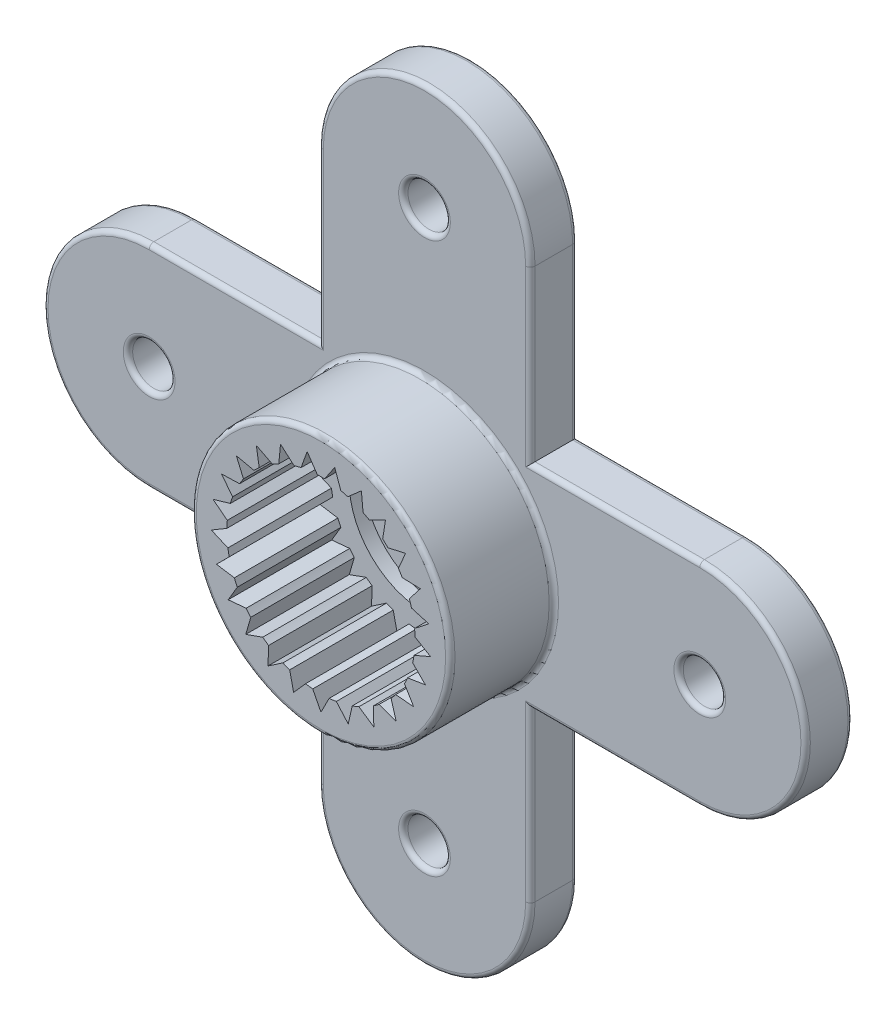
from build123d import *

# Parameters (mm, degrees)
ESQUISSE1_R             = 2.75
BOSS_EXTRU_1_DEPTH      = 1
ESQUISSE2_R             = 2.75
BOSS_EXTRU_2_DEPTH      = 2.2
ESQUISSE3_R             = 2
ENL_V_MAT_EXTRU_1_DEPTH = 2.5
ESQUISSE4_R             = 1.6
ENL_V_MAT_EXTRU_2_DEPTH = 0.4
ESQUISSE5_R             = 0.85
ENL_V_MAT_EXTRU_3_DEPTH = 4.8
ESQUISSE6_R             = 0.45
ENL_V_MAT_EXTRU_4_DEPTH = 10.133044399
CUT_EXTRUDE1_DEPTH      = 2.5
CIRPATTERN1_COUNT       = 25
BOSS_EXTRUDE1_DEPTH     = 1
SKETCH3_R               = 0.45
CUT_EXTRUDE2_DEPTH      = 10.133044399
SKETCH5_R               = 1.6
BOSS_EXTRUDE3_DEPTH     = 1
SKETCH9_R               = 0.45
CUT_EXTRUDE6_DEPTH      = 12.893695809
FILLET5_R               = 0.1


with BuildPart() as part:
    # Esquisse1 → Boss.-Extru.1 (new body)
    with BuildSketch(Plane.XY):
        with BuildLine():
            ThreePointArc((2.25, 5.85), (0, 8.1), (-2.25, 5.85))
            Line((-2.25, 5.85), (-2.25, 1.58113883))
            ThreePointArc((-2.25, 1.58113883), (0, 2.75), (2.25, 1.58113883))
            Line((2.25, 1.58113883), (2.25, 5.85))
        make_face()
        Circle(ESQUISSE1_R)
    extrude(amount=BOSS_EXTRU_1_DEPTH)

    # Esquisse2 → Boss.-Extru.2 (add)
    with BuildSketch(Plane.XY.offset(1)):
        with Locations(Location((0, 0, 0), (0, 0, 144.903198772))):
            Circle(ESQUISSE2_R)
    extrude(amount=BOSS_EXTRU_2_DEPTH)

    # Esquisse3 → Enlèv. mat.-Extru.1 (cut)
    with BuildSketch(Plane.XY.offset(3.2)):
        Circle(ESQUISSE3_R)
    extrude(amount=-ENL_V_MAT_EXTRU_1_DEPTH, mode=Mode.SUBTRACT)

    # Esquisse4 → Enlèv. mat.-Extru.2 (cut)
    with BuildSketch(Plane(origin=(0, 0, 0), x_dir=(-1, 0, 0), z_dir=(0, 0, -1))):
        Circle(ESQUISSE4_R)
    extrude(amount=-ENL_V_MAT_EXTRU_2_DEPTH, mode=Mode.SUBTRACT)

    # Esquisse5 → Enlèv. mat.-Extru.3 (cut)
    with BuildSketch(Plane(origin=(0, 0, 0.4), x_dir=(-1, 0, 0), z_dir=(0, 0, -1))):
        Circle(ESQUISSE5_R)
    extrude(amount=-ENL_V_MAT_EXTRU_3_DEPTH, mode=Mode.SUBTRACT)

    # Esquisse6 → Enlèv. mat.-Extru.4 (cut, through all)
    with BuildSketch(Plane(origin=(0, 0, 0), x_dir=(-1, 0, 0), z_dir=(0, 0, -1))):
        with Locations((0, 5.85)):
            Circle(ESQUISSE6_R)
    extrude(amount=-ENL_V_MAT_EXTRU_4_DEPTH, mode=Mode.SUBTRACT)

    # Sketch1 → Cut-Extrude1 (cut)
    with BuildSketch(Plane.XY.offset(3.2)):
        with BuildLine():
            Line((0.174311485, -1.992389396), (0, -2.334))
            Line((0, -2.334), (-0.174311485, -1.992389396))
            ThreePointArc((-0.174311485, -1.992389396), (0, -2), (0.174311485, -1.992389396))
        make_face()
    cut_extrude1 = extrude(amount=-CUT_EXTRUDE1_DEPTH, mode=Mode.SUBTRACT)

    # CirPattern1: Cut-Extrude1 ×25 about axis
    cirpattern1_axis = Axis((0, 0, 0), (0, 0, 1))
    for i in range(1, CIRPATTERN1_COUNT):
        add(cut_extrude1.rotate(cirpattern1_axis, i * 360 / CIRPATTERN1_COUNT), mode=Mode.SUBTRACT)

    # Sketch2 → Boss-Extrude1 (add)
    with BuildSketch(Plane(origin=(0, 0, 0), x_dir=(-1, 0, 0), z_dir=(0, 0, -1))):
        with BuildLine():
            Line((2.25, -1.58113883), (2.25, -5.85))
            ThreePointArc((2.25, -5.85), (0, -8.1), (-2.25, -5.85))
            Line((-2.25, -5.85), (-2.25, -1.58113883))
            ThreePointArc((-2.25, -1.58113883), (0, -2.75), (2.25, -1.58113883))
        make_face()
    extrude(amount=-BOSS_EXTRUDE1_DEPTH)

    # Sketch3 → Cut-Extrude2 (cut, through all)
    with BuildSketch(Plane(origin=(0, 0, 0), x_dir=(-1, 0, 0), z_dir=(0, 0, -1))):
        with Locations((0, -5.85)):
            Circle(SKETCH3_R)
    extrude(amount=-CUT_EXTRUDE2_DEPTH, mode=Mode.SUBTRACT)

    # Sketch5 → Boss-Extrude3 (add)
    with BuildSketch(Plane(origin=(0, 0, 0), x_dir=(-1, 0, 0), z_dir=(0, 0, -1))):
        with BuildLine():
            Line((5.85, 2.25), (-5.85, 2.25))
            ThreePointArc((-5.85, 2.25), (-8.1, 0), (-5.85, -2.25))
            Line((-5.85, -2.25), (5.85, -2.25))
            ThreePointArc((5.85, -2.25), (8.1, 0), (5.85, 2.25))
        make_face()
        Circle(SKETCH5_R, mode=Mode.SUBTRACT)
    extrude(amount=-BOSS_EXTRUDE3_DEPTH)

    # Sketch9 → Cut-Extrude6 (cut, through all)
    with BuildSketch(Plane(origin=(0, 0, 0), x_dir=(-1, 0, 0), z_dir=(0, 0, -1))):
        with Locations((5.85, 0)):
            Circle(SKETCH9_R)
        with Locations((-5.85, 0)):
            Circle(SKETCH9_R)
    extrude(amount=-CUT_EXTRUDE6_DEPTH, mode=Mode.SUBTRACT)

    # Fillet5
    fillet5_edges = [part.edges().sort_by_distance(p)[0] for p in [
        (-2.25, 4.05, 1),
        (2.25, -1.58113883, 1),
        (2.25, -1.58113883, 3.2),
        (1.6, 0, 0),
        (0, -8.1, 1),
        (0, -8.1, 0),
        (0.45, -5.85, 1),
        (0.45, -5.85, 0),
        (-2.25, -4.05, 1),
        (-2.25, -4.05, 0),
        (2.25, -4.05, 1),
        (2.25, -4.05, 0),
        (0.45, 5.85, 1),
        (0.45, 5.85, 0),
        (-4.05, 2.25, 1),
        (4.05, 2.25, 1),
        (-4.05, -2.25, 1),
        (-4.05, 2.25, 0),
        (-4.05, -2.25, 0),
        (-8.1, 0, 0),
        (-8.1, 0, 1),
        (4.05, -2.25, 1),
        (8.1, 0, 1),
        (4.05, 2.25, 0),
        (8.1, 0, 0),
        (2.25, 4.05, 1),
        (4.05, -2.25, 0),
        (-5.4, 0, 1),
        (-5.4, 0, 0),
        (6.3, 0, 1),
        (6.3, 0, 0),
        (-2.25, 4.05, 0),
        (0, 8.1, 0),
        (2.25, 4.05, 0),
        (0, 8.1, 1),
    ]]
    fillet(fillet5_edges, radius=FILLET5_R)


solid = part.part
